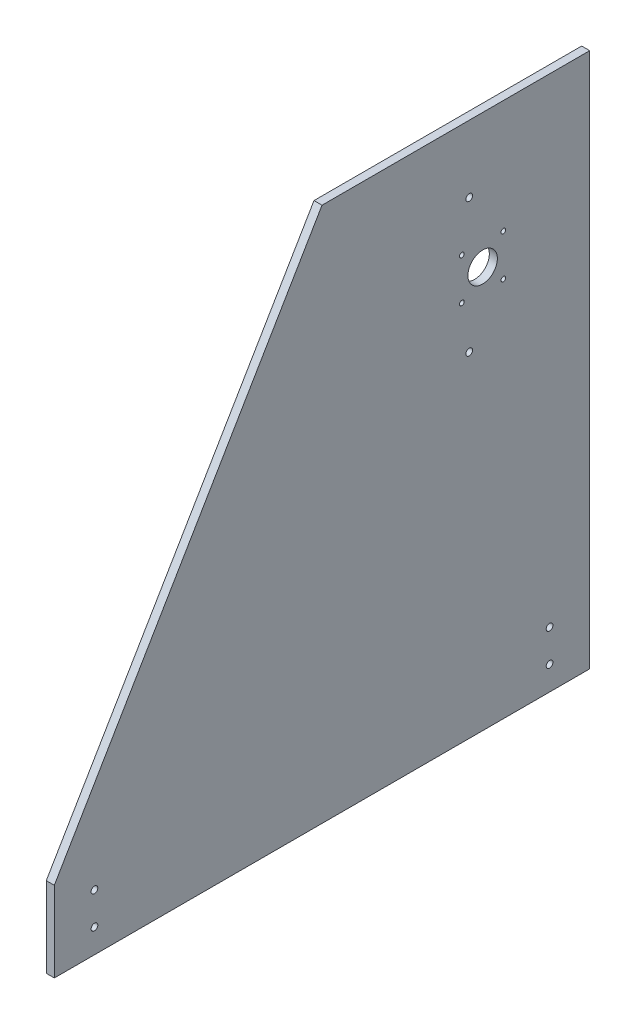
from build123d import *

# Parameters (mm, degrees)
SKETCH1_R           = 2.5
SKETCH1_R_2         = 11
SKETCH1_R_3         = 1.75
BOSS_EXTRUDE1_DEPTH = 6


with BuildPart() as part:
    # Sketch1 → Boss-Extrude1 (new body)
    with BuildSketch(Plane(origin=(0, 0, 0), x_dir=(0, 0, -1), z_dir=(1, 0, 0))):
        Polygon((0, 0), (400, 0), (400, 400), (200, 400), (0, 60), align=None)
        with Locations((30, 42)):
            Circle(SKETCH1_R, mode=Mode.SUBTRACT)
        with Locations(Location((30, 18, 0), (0, 0, 180))):
            Circle(SKETCH1_R, mode=Mode.SUBTRACT)
        with Locations((370, 18)):
            Circle(SKETCH1_R, mode=Mode.SUBTRACT)
        with Locations(Location((370, 42, 0), (0, 0, 180))):
            Circle(SKETCH1_R, mode=Mode.SUBTRACT)
        with Locations((310, 350)):
            Circle(SKETCH1_R, mode=Mode.SUBTRACT)
        with Locations((310, 250)):
            Circle(SKETCH1_R, mode=Mode.SUBTRACT)
        with Locations((320, 300)):
            Circle(SKETCH1_R_2, mode=Mode.SUBTRACT)
        with Locations((335.5, 315.5)):
            Circle(SKETCH1_R_3, mode=Mode.SUBTRACT)
        with Locations(Location((304.5, 315.5, 0), (0, 0, 180))):
            Circle(SKETCH1_R_3, mode=Mode.SUBTRACT)
        with Locations((304.5, 284.5)):
            Circle(SKETCH1_R_3, mode=Mode.SUBTRACT)
        with Locations(Location((335.5, 284.5, 0), (0, 0, 180))):
            Circle(SKETCH1_R_3, mode=Mode.SUBTRACT)
    extrude(amount=BOSS_EXTRUDE1_DEPTH)


solid = part.part
